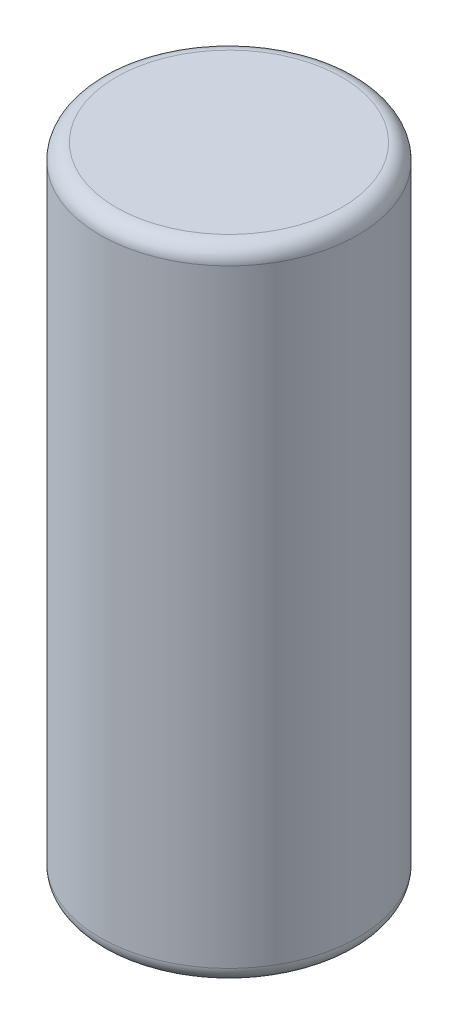
from build123d import *

# Parameters (mm, degrees)
SKETCH2_R           = 4.025
BOSS_EXTRUDE1_DEPTH = 20
FILLET1_R           = 0.5


with BuildPart() as part:
    # Sketch2 → Boss-Extrude1 (new body)
    with BuildSketch(Plane(origin=(0, 0, 0), x_dir=(1, 0, 0), z_dir=(0, 1, 0))):
        with Locations(Location((0, 0, 0), (0, 0, 270))):
            Circle(SKETCH2_R)
    extrude(amount=BOSS_EXTRUDE1_DEPTH)

    # Fillet1
    fillet1_edges = [part.edges().sort_by_distance(p)[0] for p in [
        (0, 0, -4.025),
        (0, 20, -4.025),
    ]]
    fillet(fillet1_edges, radius=FILLET1_R)


solid = part.part
